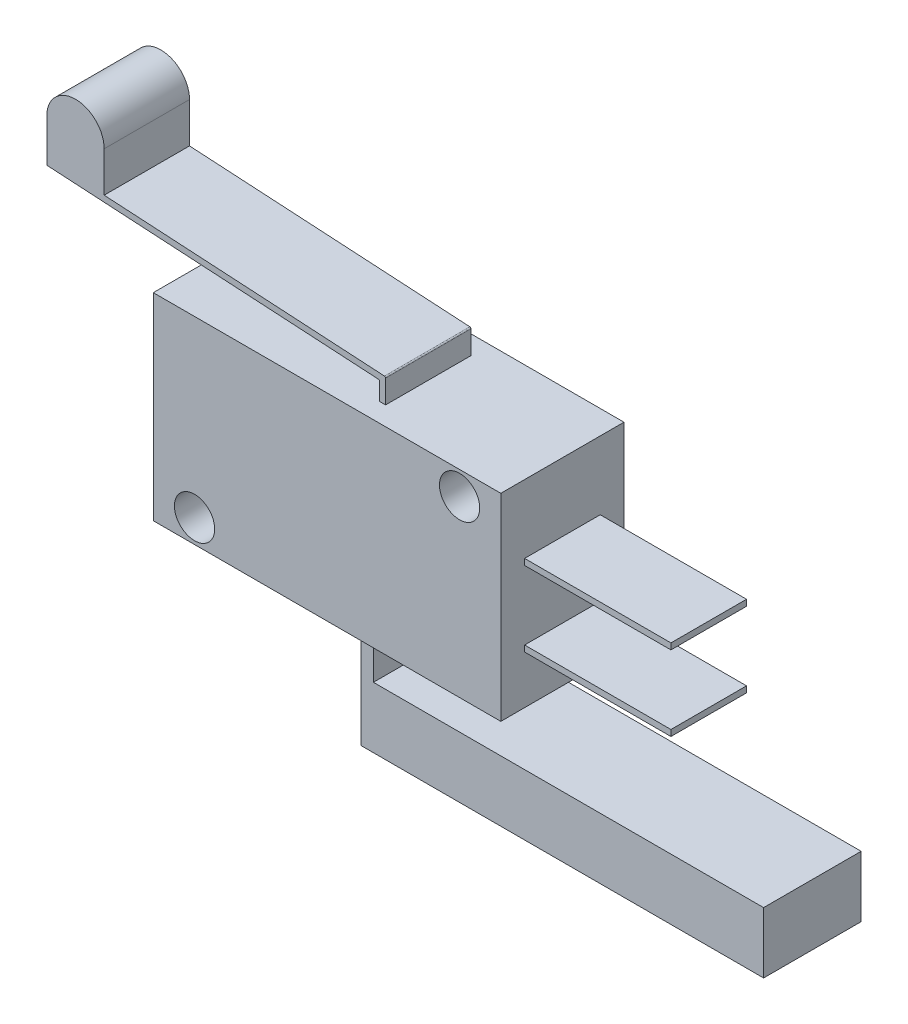
from build123d import *

# Parameters (mm, degrees)
ESQUISSE1_W        = 28.5
ESQUISSE1_H        = 16.2
ESQUISSE1_R        = 1.65
BOSS_EXTRU_1_DEPTH = 5.05
BOSS_EXTRU_2_DEPTH = 3.5
CONG_1_R           = 0.1
ESQUISSE3_W        = 6.2
ESQUISSE3_H        = 0.5
BOSS_EXTRU_3_DEPTH = 12
BOSS_EXTRU_4_DEPTH = 4


with BuildPart() as part:
    # Esquisse1 → Boss.-Extru.1 (new, symmetric)
    with BuildSketch(Plane.XY):
        Rectangle(ESQUISSE1_W, ESQUISSE1_H)
        with Locations((-10.866713513, -6.176868734)):
            Circle(ESQUISSE1_R, mode=Mode.SUBTRACT)
        with Locations((10.867466751, 6.17729689)):
            Circle(ESQUISSE1_R, mode=Mode.SUBTRACT)
    extrude(amount=BOSS_EXTRU_1_DEPTH, both=True)

    # Esquisse2 → Boss.-Extru.2 (add, symmetric)
    with BuildSketch(Plane.XY):
        with BuildLine():
            Line((2.75, 8.1), (2.75, 9.628523069))
            Line((2.75, 9.628523069), (-24.53, 11.231815184))
            Line((-24.53, 11.231815184), (-24.53, 14.75))
            ThreePointArc((-24.53, 14.75), (-22.18, 17.1), (-19.83, 14.75))
            Line((-19.83, 14.75), (-19.83, 11.456450954))
            Line((-19.83, 11.456450954), (3.25, 10.1))
            Line((3.25, 10.1), (3.25, 8.1))
            Line((3.25, 8.1), (2.75, 8.1))
        make_face()
    extrude(amount=BOSS_EXTRU_2_DEPTH, both=True)

    # Congé1
    cong_1_edges = [part.edges().sort_by_distance(p)[0] for p in [
        (3.25, 10.1, 0),
        (2.75, 9.628523069, 0),
    ]]
    fillet(cong_1_edges, radius=CONG_1_R)

    # Esquisse3 → Boss.-Extru.3 (add)
    with BuildSketch(Plane(origin=(14.25, 0, 0), x_dir=(0, 0, -1), z_dir=(1, 0, 0))):
        with Locations((0, 2.25)):
            Rectangle(ESQUISSE3_W, ESQUISSE3_H)
        with Locations((0, -3.9)):
            Rectangle(ESQUISSE3_W, ESQUISSE3_H)
    extrude(amount=BOSS_EXTRU_3_DEPTH)

    # Esquisse4 → Boss.-Extru.4 (add, symmetric)
    with BuildSketch(Plane.XY):
        Polygon((2.75, -8.1), (2.75, -11.6), (34.75, -11.6), (34.75, -16.6), (1.75, -16.6), (1.75, -8.1), align=None)
    extrude(amount=BOSS_EXTRU_4_DEPTH, both=True)


solid = part.part
